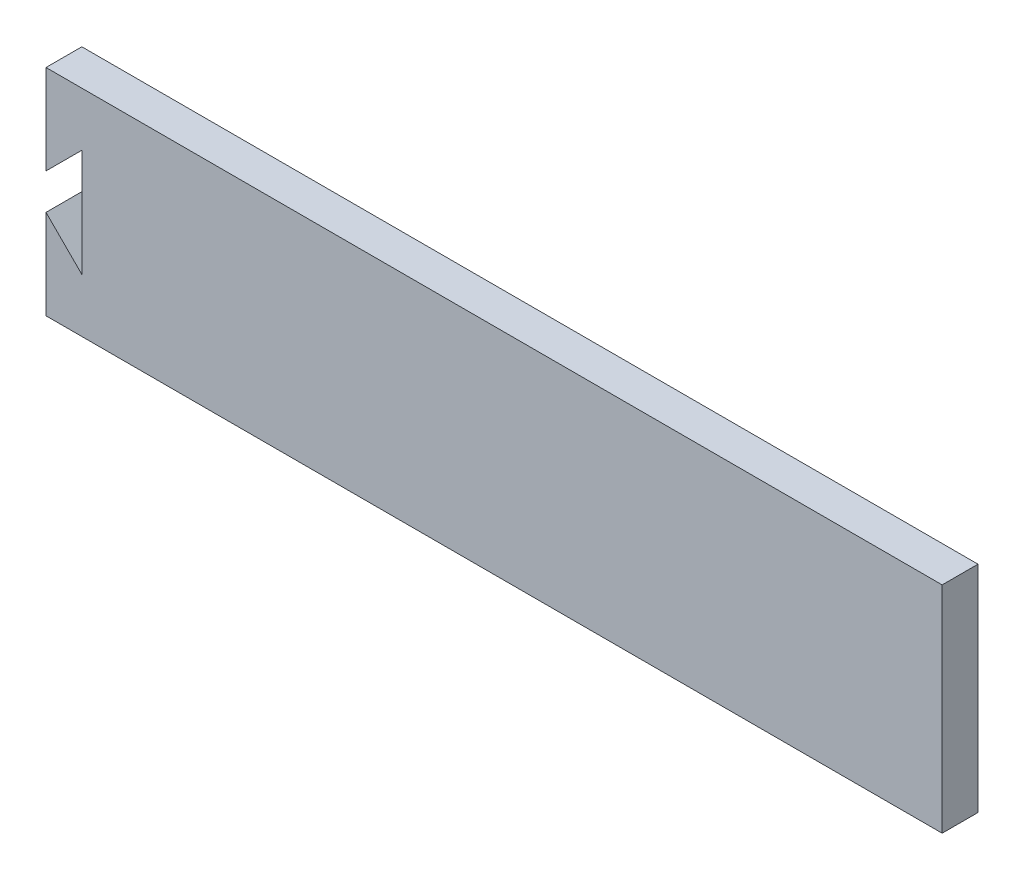
from build123d import *

# Parameters (mm, degrees)
SKETCH_1_W          = 250
SKETCH_1_H          = 60
EXTRUDE_1_DEPTH     = 10
SKETCH_8_W          = 10
SKETCH_8_H          = 10
CUT_EXTRUDE_3_DEPTH = 10
CUT_EXTRUDE_4_DEPTH = 10
CUT_EXTRUDE_5_DEPTH = 10


with BuildPart() as part:
    # 草图1 → 凸台-拉伸1 (new body)
    with BuildSketch(Plane.XY):
        with Locations((-17.927308448, 36.060903733)):
            Rectangle(SKETCH_1_W, SKETCH_1_H)
    extrude(amount=EXTRUDE_1_DEPTH)

    # 草图8 → 切除-拉伸3 (cut)
    with BuildSketch(Plane.ZY.offset(142.927308448)):
        with Locations((5, 36.060903733)):
            Rectangle(SKETCH_8_W, SKETCH_8_H)
    extrude(amount=-CUT_EXTRUDE_3_DEPTH, mode=Mode.SUBTRACT)

    # 草图9 → 切除-拉伸4 (cut)
    with BuildSketch(Plane.XY.offset(10)):
        Polygon((-142.927308448, 41.060903733), (-132.927308448, 51.060903733), (-132.927308448, 41.060903733), align=None)
    extrude(amount=-CUT_EXTRUDE_4_DEPTH, mode=Mode.SUBTRACT)

    # 草图10 → 切除-拉伸5 (cut)
    with BuildSketch(Plane.XY.offset(10)):
        Polygon((-142.927308448, 31.060903733), (-132.927308448, 21.060903733), (-132.927308448, 31.060903733), align=None)
    extrude(amount=-CUT_EXTRUDE_5_DEPTH, mode=Mode.SUBTRACT)


solid = part.part
